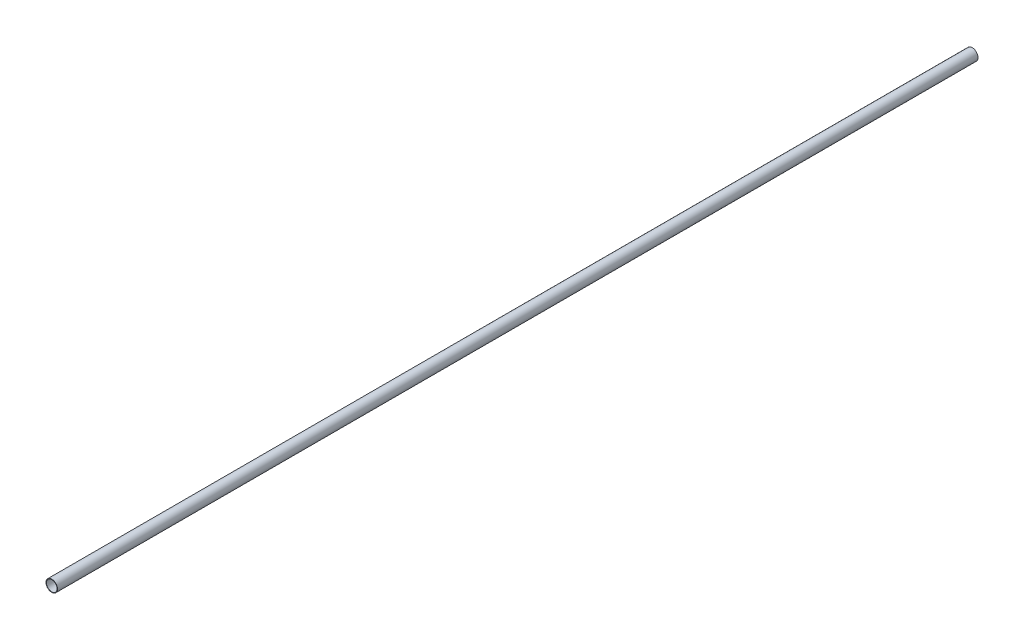
from build123d import *

# Parameters (mm, degrees)
SKETCH1_R           = 12.5
SKETCH1_R_2         = 11.5
BOSS_EXTRUDE1_DEPTH = 2000


with BuildPart() as part:
    # Sketch1 → Boss-Extrude1 (new body)
    with BuildSketch(Plane.XY):
        Circle(SKETCH1_R)
        Circle(SKETCH1_R_2, mode=Mode.SUBTRACT)
    extrude(amount=-BOSS_EXTRUDE1_DEPTH)


solid = part.part
